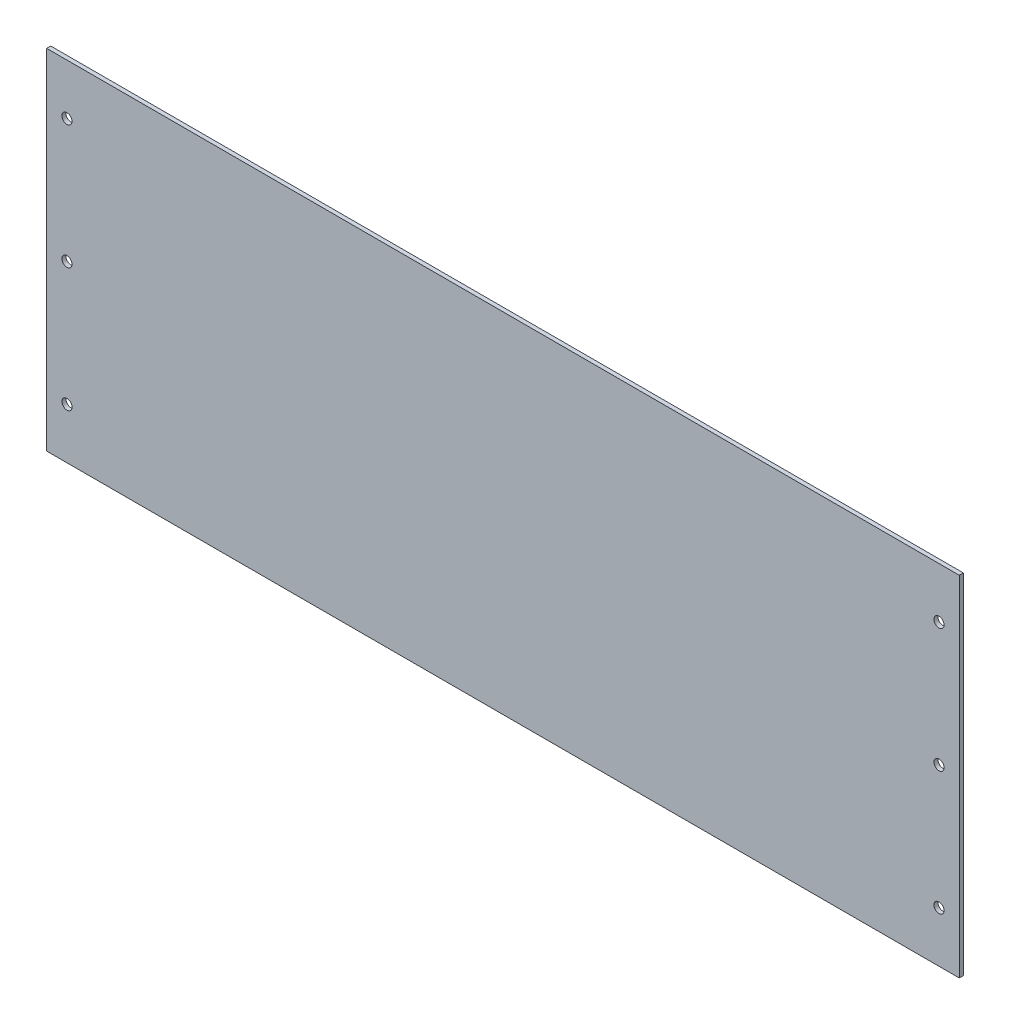
from build123d import *

# Parameters (mm, degrees)
SKETCH1_W           = 450
SKETCH1_H           = 172
BOSS_EXTRUDE1_DEPTH = 2
SKETCH2_R           = 2.5
CUT_EXTRUDE1_DEPTH  = 241.883789409


with BuildPart() as part:
    # Sketch1 → Boss-Extrude1 (new body)
    with BuildSketch(Plane.XY):
        Rectangle(SKETCH1_W, SKETCH1_H)
    extrude(amount=BOSS_EXTRUDE1_DEPTH)

    # Sketch2 → Cut-Extrude1 (cut, through all)
    with BuildSketch(Plane.XY.offset(2)):
        with Locations((-215, 61)):
            Circle(SKETCH2_R)
        with Locations((215, 61)):
            Circle(SKETCH2_R)
        with Locations((215, -61)):
            Circle(SKETCH2_R)
        with Locations((-215, -61)):
            Circle(SKETCH2_R)
        with Locations((-215, 0)):
            Circle(SKETCH2_R)
        with Locations((215, 0)):
            Circle(SKETCH2_R)
    extrude(amount=-CUT_EXTRUDE1_DEPTH, mode=Mode.SUBTRACT)


solid = part.part
